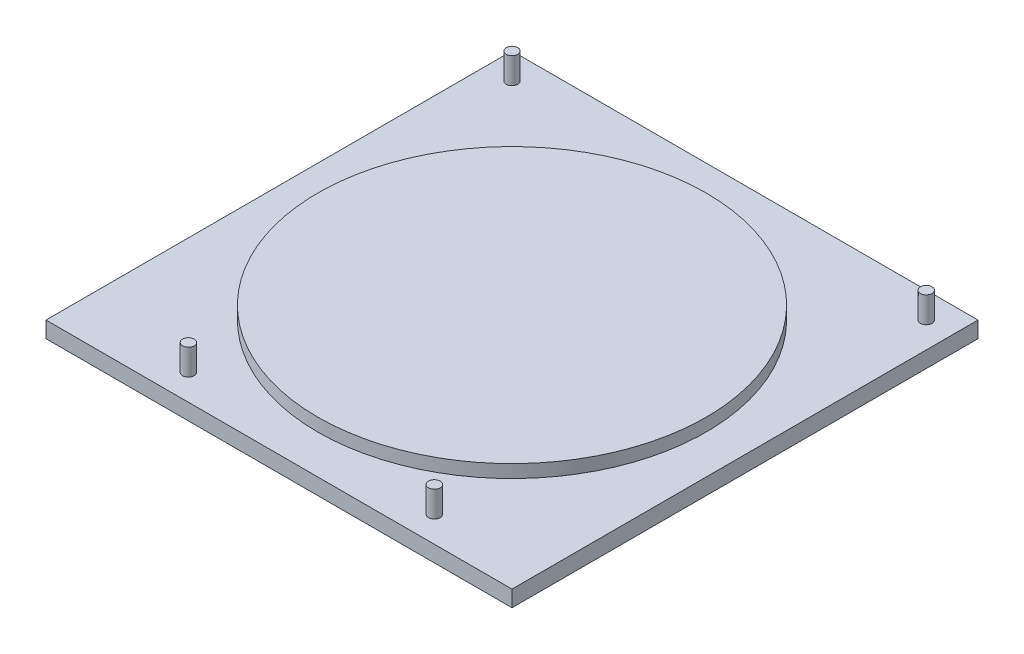
from build123d import *

# Parameters (mm, degrees)
SKETCH1_W           = 91.44
SKETCH1_H           = 91.44
BOSS_EXTRUDE1_DEPTH = 3.175
SKETCH2_R           = 38.1
BOSS_EXTRUDE2_DEPTH = 2.54
SKETCH4_R           = 1.143
BOSS_EXTRUDE4_DEPTH = 5.08
SKETCH5_R           = 1.143
BOSS_EXTRUDE5_DEPTH = 5.08


with BuildPart() as part:
    # Sketch1 → Boss-Extrude1 (new body)
    with BuildSketch(Plane(origin=(0, 0, 0), x_dir=(1, 0, 0), z_dir=(0, 1, 0))):
        with Locations((32.163488372, -2.791046512)):
            Rectangle(SKETCH1_W, SKETCH1_H)
    extrude(amount=BOSS_EXTRUDE1_DEPTH)

    # Sketch2 → Boss-Extrude2 (add)
    with BuildSketch(Plane(origin=(0, 3.175, 0), x_dir=(1, 0, 0), z_dir=(0, 1, 0))):
        with Locations(Location((32.163488372, -2.791046512, 0), (0, 0, 270))):
            Circle(SKETCH2_R)
    extrude(amount=BOSS_EXTRUDE2_DEPTH)

    # Sketch4 → Boss-Extrude4 (add)
    with BuildSketch(Plane(origin=(0, 3.175, 0), x_dir=(1, 0, 0), z_dir=(0, 1, 0))):
        with Locations(Location((9.303488372, -43.431046512, 0), (0, 0, 270))):
            Circle(SKETCH4_R)
        with Locations(Location((57.563488372, -43.431046512, 0), (0, 0, 270))):
            Circle(SKETCH4_R)
    extrude(amount=BOSS_EXTRUDE4_DEPTH)

    # Sketch5 → Boss-Extrude5 (add)
    with BuildSketch(Plane(origin=(0, 3.175, 0), x_dir=(1, 0, 0), z_dir=(0, 1, 0))):
        with Locations(Location((-8.476511628, 37.848953488, 0), (0, 0, 270))):
            Circle(SKETCH5_R)
        with Locations(Location((72.803488372, 37.848953488, 0), (0, 0, 270))):
            Circle(SKETCH5_R)
    extrude(amount=BOSS_EXTRUDE5_DEPTH)


solid = part.part
